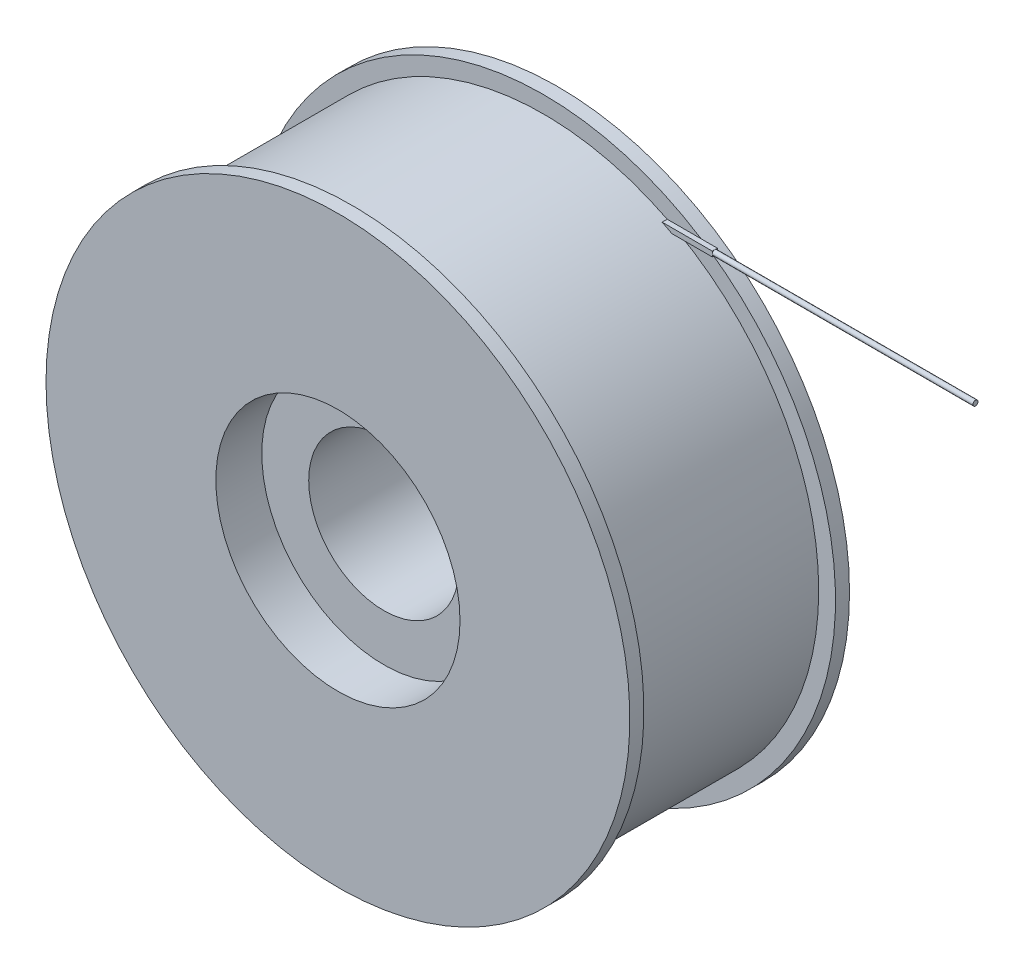
from build123d import *

# Parameters (mm, degrees)
SKETCH1_R           = 100.8
SKETCH1_R_2         = 25.95
BOSS_EXTRUDE1_DEPTH = 4.84
SKETCH2_R           = 45.11
SKETCH2_R_2         = 25.95
BOSS_EXTRUDE2_DEPTH = 66.17
SKETCH3_R           = 100.8
SKETCH3_R_2         = 25.95
BOSS_EXTRUDE3_DEPTH = 4.84
SKETCH4_R           = 42.16
CUT_EXTRUDE1_DEPTH  = 15.86
BOSS_EXTRUDE4_START = 66.17
SKETCH5_R           = 95
SKETCH5_R_2         = 45.11
BOSS_EXTRUDE4_DEPTH = 66.17
SKETCH6_W           = 150
SKETCH6_H           = 1.75
BOSS_EXTRUDE5_DEPTH = 1.75
CUT_EXTRUDE5_DEPTH  = 90
SKETCH11_W          = 101.173290866
SKETCH11_H          = 1.75
CUT_EXTRUDE6_DEPTH  = 1.75


with BuildPart() as part:
    # Sketch1 → Boss-Extrude1 (new body)
    with BuildSketch(Plane.XY):
        with Locations(Location((0, 0, 0), (0, 0, 180))):
            Circle(SKETCH1_R)
        with Locations(Location((0, 0, 0), (0, 0, 180))):
            Circle(SKETCH1_R_2, mode=Mode.SUBTRACT)
    extrude(amount=BOSS_EXTRUDE1_DEPTH)

    # Sketch2 → Boss-Extrude2 (add)
    with BuildSketch(Plane.XY.offset(4.84)):
        Circle(SKETCH2_R)
        with Locations(Location((0, 0, 0), (0, 0, 180))):
            Circle(SKETCH2_R_2, mode=Mode.SUBTRACT)
    extrude(amount=BOSS_EXTRUDE2_DEPTH)

    # Sketch3 → Boss-Extrude3 (add)
    with BuildSketch(Plane.XY.offset(71.01)):
        with Locations(Location((0, 0, 0), (0, 0, 180))):
            Circle(SKETCH3_R)
        with Locations(Location((0, 0, 0), (0, 0, 180))):
            Circle(SKETCH3_R_2, mode=Mode.SUBTRACT)
    extrude(amount=BOSS_EXTRUDE3_DEPTH)

    # Sketch4 → Cut-Extrude1 (cut)
    with BuildSketch(Plane.XY.offset(75.85)):
        Circle(SKETCH4_R)
    extrude(amount=-CUT_EXTRUDE1_DEPTH, mode=Mode.SUBTRACT)

    # Sketch5 → Boss-Extrude4 (add)
    with BuildSketch(Plane(origin=(0, 0, 71.01), x_dir=(-1, 0, 0), z_dir=(0, 0, -1)).offset(BOSS_EXTRUDE4_START)):
        with Locations(Location((0, 0, 0), (0, 0, 180))):
            Circle(SKETCH5_R)
        Circle(SKETCH5_R_2, mode=Mode.SUBTRACT)
    boss_extrude4 = extrude(amount=-BOSS_EXTRUDE4_DEPTH)

    # Sketch6 → Boss-Extrude5 (add)
    with BuildSketch(Plane.XY.offset(4.84)):
        with Locations((75, -83.995)):
            Rectangle(SKETCH6_W, SKETCH6_H)
    boss_extrude5 = extrude(amount=BOSS_EXTRUDE5_DEPTH)

    # Sketch7 → Cut-Extrude5 (cut)
    with BuildSketch(Plane(origin=(150, 0, 0), x_dir=(0, 0, -1), z_dir=(1, 0, 0))):
        with BuildLine():
            Line((-6.333718434, -83.376281566), (-6.59, -83.12))
            Line((-6.59, -83.12), (-6.59, -83.995))
            ThreePointArc((-6.59, -83.995), (-6.523394591, -83.660151997), (-6.333718434, -83.376281566))
        make_face()
        with BuildLine():
            Line((-5.715, -83.12), (-6.59, -83.12))
            Line((-6.59, -83.12), (-6.333718434, -83.376281566))
            ThreePointArc((-6.333718434, -83.376281566), (-6.049848003, -83.186605409), (-5.715, -83.12))
        make_face()
        with BuildLine():
            Line((-4.84, -83.12), (-5.715, -83.12))
            ThreePointArc((-5.715, -83.12), (-5.096281566, -83.376281566), (-4.84, -83.995))
            Line((-4.84, -83.995), (-4.84, -83.12))
        make_face()
        with BuildLine():
            ThreePointArc((-4.84, -83.995), (-4.906605409, -84.329848003), (-5.096281566, -84.613718434))
            Line((-5.096281566, -84.613718434), (-4.84, -84.87))
            Line((-4.84, -84.87), (-4.84, -83.995))
        make_face()
        with BuildLine():
            Line((-4.84, -84.87), (-5.096281566, -84.613718434))
            ThreePointArc((-5.096281566, -84.613718434), (-5.380151997, -84.803394591), (-5.715, -84.87))
            Line((-5.715, -84.87), (-4.84, -84.87))
        make_face()
        with BuildLine():
            ThreePointArc((-5.715, -84.87), (-6.333718434, -84.613718434), (-6.59, -83.995))
            Line((-6.59, -83.995), (-6.59, -84.87))
            Line((-6.59, -84.87), (-5.715, -84.87))
        make_face()
    cut_extrude5 = extrude(amount=-CUT_EXTRUDE5_DEPTH, mode=Mode.SUBTRACT)

    # Mirror5: Boss-Extrude4, Boss-Extrude5, Cut-Extrude5 across plane
    add(boss_extrude4.mirror(Plane.ZX))
    add(boss_extrude5.mirror(Plane.ZX))
    add(cut_extrude5.mirror(Plane.ZX), mode=Mode.SUBTRACT)

    # Sketch11 → Cut-Extrude6 (cut)
    with BuildSketch(Plane.XZ.offset(84.87)):
        with Locations((99.413354567, 5.715)):
            Rectangle(SKETCH11_W, SKETCH11_H)
    extrude(amount=-CUT_EXTRUDE6_DEPTH, mode=Mode.SUBTRACT)


solid = part.part
